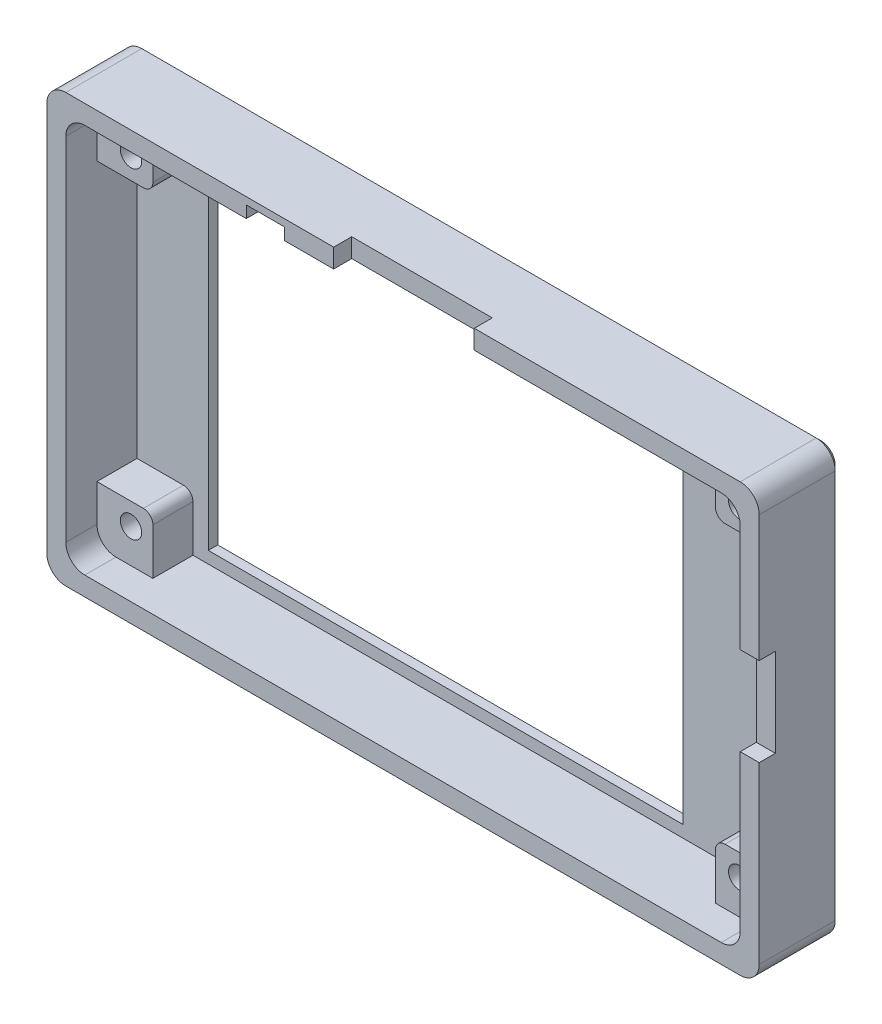
from build123d import *

# Parameters (mm, degrees)
SKICA1_W                 = 75
SKICA1_H                 = 45
P_IDAT_VYSUNUT_M1_DEPTH  = 13
SKICA2_W                 = 71
SKICA2_H                 = 41
ODEBRAT_VYSUNUT_M1_DEPTH = 12
ZAOBLIT1_R               = 2
ZKOSEN_2_SIZE            = 0.5
SKICA3_W                 = 50
SKICA3_H                 = 38.5
ODEBRAT_VYSUNUT_M2_DEPTH = 6
SKICA4_W                 = 7.3
SKICA4_H                 = 7.3
P_IDAT_VYSUNUT_M2_DEPTH  = 4.22
ZAOBLIT2_R               = 1
SKICA6_W                 = 92.209043038
SKICA6_H                 = 16.914138174
ODEBRAT_VYSUNUT_M3_DEPTH = 64.22
SKICA5_W                 = 5.279513812
SKICA5_H                 = 9.3
ODEBRAT_VYSUNUT_M4_DEPTH = 6.2
SKICA7_W                 = 4
SKICA7_H                 = 7.314220015
ODEBRAT_VYSUNUT_M5_DEPTH = 1.9
SKICA8_W                 = 14.8
SKICA8_H                 = 7.292326558
ODEBRAT_VYSUNUT_M6_DEPTH = 1.9
SKICA9_R                 = 1.125
ODEBRAT_VYSUNUT_M7_DEPTH = 3


with BuildPart() as part:
    # Skica1 → Přidat vysunutím1 (new body)
    with BuildSketch(Plane.XY):
        Rectangle(SKICA1_W, SKICA1_H)
    extrude(amount=P_IDAT_VYSUNUT_M1_DEPTH)

    # Skica2 → Odebrat vysunutím1 (cut)
    with BuildSketch(Plane.XY.offset(13)):
        Rectangle(SKICA2_W, SKICA2_H)
    extrude(amount=-ODEBRAT_VYSUNUT_M1_DEPTH, mode=Mode.SUBTRACT)

    # Zaoblit1
    zaoblit1_edges = [part.edges().sort_by_distance(p)[0] for p in [
        (35.5, 20.5, 7),
        (35.5, -20.5, 7),
        (-35.5, -20.5, 7),
        (-35.5, 20.5, 7),
        (37.5, -22.5, 6.5),
        (-37.5, -22.5, 6.5),
        (-37.5, 22.5, 6.5),
        (37.5, 22.5, 6.5),
    ]]
    fillet(zaoblit1_edges, radius=ZAOBLIT1_R)

    # Zkosení2
    zkosen_2_edges = [part.edges().sort_by_distance(p)[0] for p in [
        (0, 22.5, 0),
        (37.5, 0, 0),
        (0, -22.5, 0),
        (-37.5, 0, 0),
        (-36.914213562, 21.914213562, 0),
        (-36.914213562, -21.914213562, 0),
        (36.914213562, -21.914213562, 0),
        (36.914213562, 21.914213562, 0),
    ]]
    chamfer(zkosen_2_edges, length=ZKOSEN_2_SIZE)

    # Skica3 → Odebrat vysunutím2 (cut, symmetric)
    with BuildSketch(Plane(origin=(0, 0, 0), x_dir=(-1, 0, 0), z_dir=(0, 0, -1))):
        with Locations((3, 0)):
            Rectangle(SKICA3_W, SKICA3_H)
    extrude(amount=ODEBRAT_VYSUNUT_M2_DEPTH, both=True, mode=Mode.SUBTRACT)

    # Skica4 → Přidat vysunutím2 (add)
    with BuildSketch(Plane.XY.offset(1)):
        with Locations((-33.264213562, 18.264213562)):
            Rectangle(SKICA4_W, SKICA4_H)
        with Locations((-33.264213562, -18.264213562)):
            Rectangle(SKICA4_W, SKICA4_H)
        with Locations((33.264213562, -18.264213562)):
            Rectangle(SKICA4_W, SKICA4_H)
        with Locations((33.264213562, 18.264213562)):
            Rectangle(SKICA4_W, SKICA4_H)
    extrude(amount=P_IDAT_VYSUNUT_M2_DEPTH)

    # Zaoblit2
    zaoblit2_edges = [part.edges().sort_by_distance(p)[0] for p in [
        (-29.614213562, 14.614213562, 3.11),
        (-29.614213562, -14.614213562, 3.11),
        (29.614213562, -14.614213562, 3.11),
        (29.614213562, 14.614213562, 3.11),
    ]]
    fillet(zaoblit2_edges, radius=ZAOBLIT2_R)

    # Skica6 → Odebrat vysunutím3 (cut)
    with BuildSketch(Plane.XZ.offset(22.5)):
        with Locations((-2.449143373, 16.957069087)):
            Rectangle(SKICA6_W, SKICA6_H)
    extrude(amount=-ODEBRAT_VYSUNUT_M3_DEPTH, mode=Mode.SUBTRACT)

    # Skica5 → Odebrat vysunutím4 (cut)
    with BuildSketch(Plane.XY.offset(13)):
        with Locations((36.7595999, 2.55)):
            Rectangle(SKICA5_W, SKICA5_H)
    extrude(amount=-ODEBRAT_VYSUNUT_M4_DEPTH, mode=Mode.SUBTRACT)

    # Skica7 → Odebrat vysunutím5 (cut)
    with BuildSketch(Plane.XY.offset(8.5)):
        with Locations((-14.5, 18.092889993)):
            Rectangle(SKICA7_W, SKICA7_H)
    extrude(amount=-ODEBRAT_VYSUNUT_M5_DEPTH, mode=Mode.SUBTRACT)

    # Skica8 → Odebrat vysunutím6 (cut)
    with BuildSketch(Plane.XY.offset(8.5)):
        with Locations((0.1, 20.570563513)):
            Rectangle(SKICA8_W, SKICA8_H)
    extrude(amount=-ODEBRAT_VYSUNUT_M6_DEPTH, mode=Mode.SUBTRACT)

    # Skica9 → Odebrat vysunutím7 (cut)
    with BuildSketch(Plane.XY.offset(5.22)):
        with Locations((-31.914213562, 16.914213562)):
            Circle(SKICA9_R)
        with Locations((-31.914213562, -16.914213562)):
            Circle(SKICA9_R)
        with Locations((32.114213562, -16.914213562)):
            Circle(SKICA9_R)
        with Locations((32.114213562, 16.914213562)):
            Circle(SKICA9_R)
    extrude(amount=-ODEBRAT_VYSUNUT_M7_DEPTH, mode=Mode.SUBTRACT)


solid = part.part
